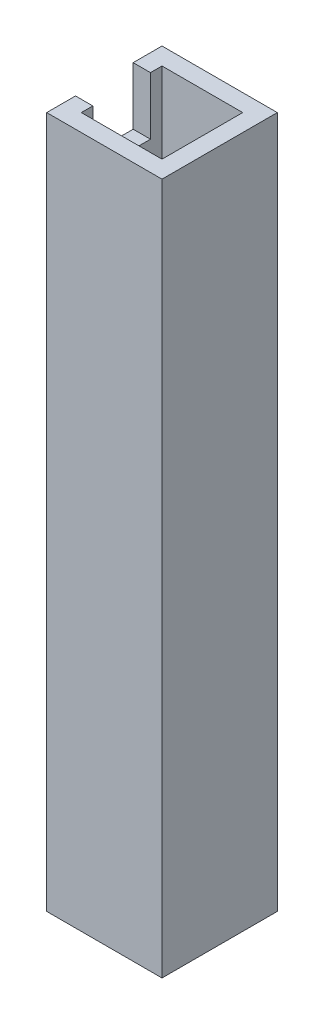
from build123d import *

# Parameters (mm, degrees)
SKETCH1_W           = 20
SKETCH1_H           = 20
BOSS_EXTRUDE1_DEPTH = 120
SHELL1_T            = -3
SKETCH2_W           = 10
SKETCH2_H           = 10
CUT_EXTRUDE1_DEPTH  = 3


with BuildPart() as part:
    # Sketch1 → Boss-Extrude1 (new body)
    with BuildSketch(Plane(origin=(0, 0, 0), x_dir=(1, 0, 0), z_dir=(0, 1, 0))):
        with Locations((1.926605505, -4.98470948)):
            Rectangle(SKETCH1_W, SKETCH1_H)
    extrude(amount=BOSS_EXTRUDE1_DEPTH)

    # Shell1
    shell1_openings = [part.faces().sort_by_distance(p)[0] for p in [
        (1.926605505, 120, 4.98470948),
        (1.926605505, 0, 4.98470948),
    ]]
    offset(amount=SHELL1_T, openings=shell1_openings, kind=Kind.INTERSECTION)

    # Sketch2 → Cut-Extrude1 (cut)
    with BuildSketch(Plane.ZY.offset(8.073394495)):
        with Locations((4.98470948, 115)):
            Rectangle(SKETCH2_W, SKETCH2_H)
    extrude(amount=-CUT_EXTRUDE1_DEPTH, mode=Mode.SUBTRACT)


solid = part.part
